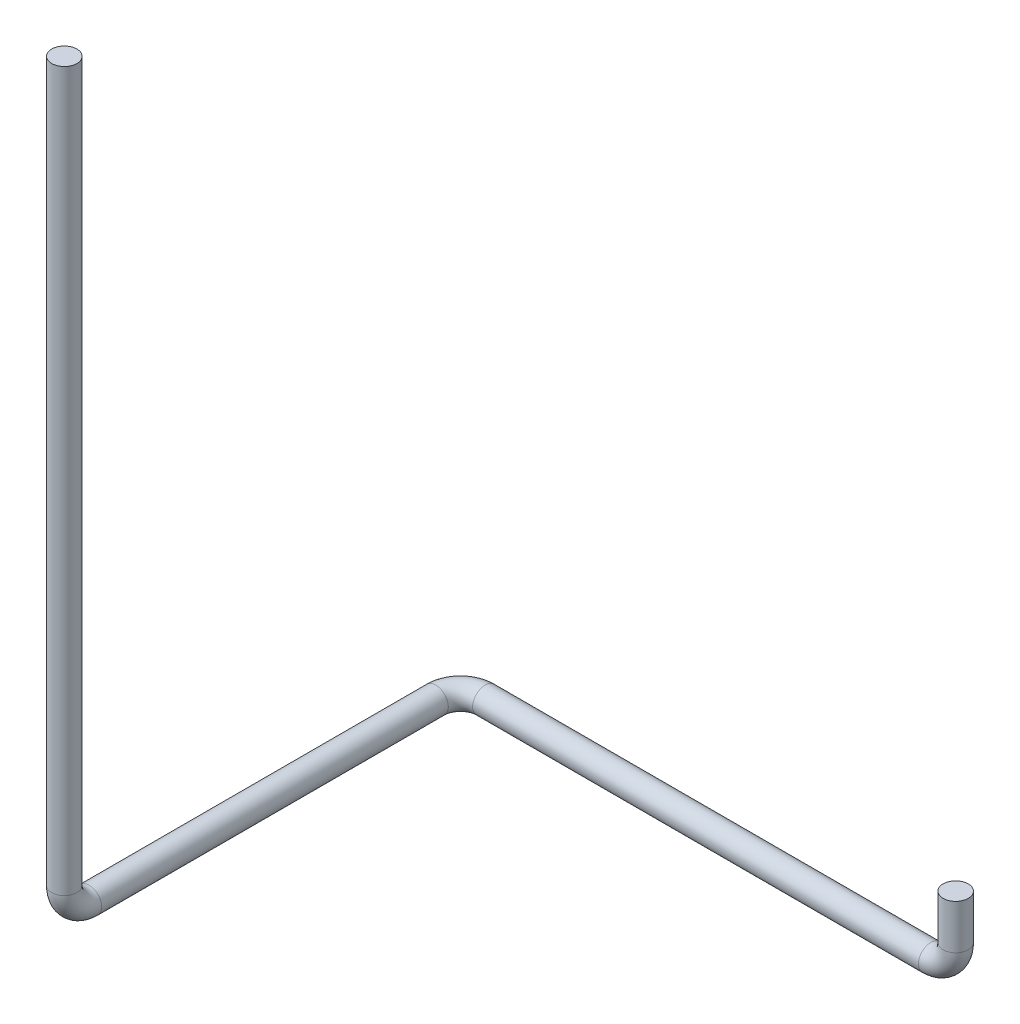
from build123d import *

# Parameters (mm, degrees)
CROQUIS1_R              = 12.7
SALIENTE_EXTRUIR1_DEPTH = 20
CROQUIS2_R              = 12.7


with BuildPart() as part:
    # Croquis1 → Saliente-Extruir1 (new body)
    with BuildSketch(Plane(origin=(0, 0, 0), x_dir=(1, 0, 0), z_dir=(0, 1, 0))):
        with Locations(Location((0, 0, 0), (0, 0, 270))):
            Circle(CROQUIS1_R)
    extrude(amount=-SALIENTE_EXTRUIR1_DEPTH)

    # Barrer1: sweep along a curve in space
    with BuildLine() as barrer1_path:
        Line((0, -20, 0), (0, -45, 0))
        ThreePointArc((0, -45, 0), (-7.32233047, -62.67766953, 0), (-25, -70, 0))
        Line((-25, -70, 0), (-475, -70, 0))
        ThreePointArc((-475, -70, 0), (-492.67766953, -70, 7.32233047), (-500, -70, 25))
        Line((-500, -70, 25), (-500, -70, 375))
        ThreePointArc((-500, -70, 375), (-500, -62.67766953, 392.67766953), (-500, -45, 400))
        Line((-500, -45, 400), (-500, 680, 400))
    # Croquis2 → Barrer1 (sweep)
    with BuildSketch(Plane.XZ.offset(20)):
        Circle(CROQUIS2_R)
    sweep(path=barrer1_path.line)


solid = part.part
